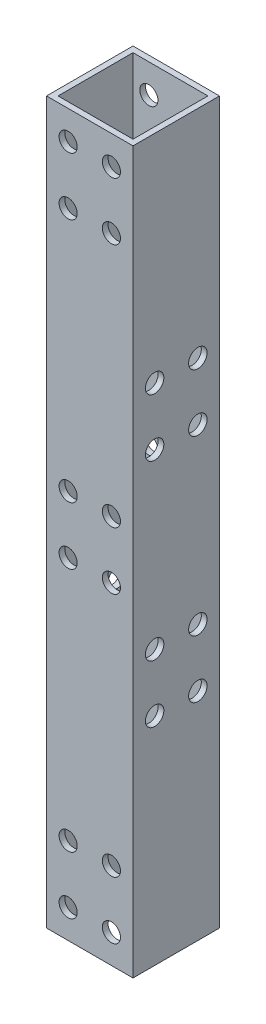
from build123d import *

# Parameters (mm, degrees)
SKETCH_1_W          = 15
SKETCH_1_H          = 15
SKETCH_1_W_2        = 13
SKETCH_1_H_2        = 13
EXTRUDE_1_DEPTH     = 125
CUT_EXTRUDE_1_REACH = 128.12
SKETCH_2_R          = 1.575
CUT_EXTRUDE_2_REACH = 128.12
SKETCH_3_R          = 1.6


with BuildPart() as part:
    # 草图1 → 凸台-拉伸1 (new body)
    with BuildSketch(Plane(origin=(0, 0, 0), x_dir=(1, 0, 0), z_dir=(0, 1, 0))):
        Rectangle(SKETCH_1_W, SKETCH_1_H)
        Rectangle(SKETCH_1_W_2, SKETCH_1_H_2, mode=Mode.SUBTRACT)
    extrude(amount=EXTRUDE_1_DEPTH)

    # 切除-拉伸1: up to this face of the body (flat: up to its plane)
    cut_extrude_1_end = Plane(part.part.faces().sort_by_distance((0, 62.5, -7.5))[0])
    # 草图2 → 切除-拉伸1 (cut, up to the picked face)
    with BuildSketch(Plane.XY.offset(7.5), mode=Mode.PRIVATE) as cut_extrude_1_sk1:
        with Locations((-3.75, 67.5)):
            Circle(SKETCH_2_R)
    cut_extrude_1_tool1 = split(extrude(cut_extrude_1_sk1.sketch, amount=-CUT_EXTRUDE_1_REACH, mode=Mode.PRIVATE), bisect_by=cut_extrude_1_end, keep=Keep.BOTH, mode=Mode.PRIVATE)
    # 草图2 → 切除-拉伸1 (cut, up to the picked face)
    with BuildSketch(Plane.XY.offset(7.5), mode=Mode.PRIVATE) as cut_extrude_1_sk2:
        with Locations((3.75, 67.5)):
            Circle(SKETCH_2_R)
    cut_extrude_1_tool2 = split(extrude(cut_extrude_1_sk2.sketch, amount=-CUT_EXTRUDE_1_REACH, mode=Mode.PRIVATE), bisect_by=cut_extrude_1_end, keep=Keep.BOTH, mode=Mode.PRIVATE)
    # 草图2 → 切除-拉伸1 (cut, up to the picked face)
    with BuildSketch(Plane.XY.offset(7.5), mode=Mode.PRIVATE) as cut_extrude_1_sk3:
        with Locations((-3.75, 57.5)):
            Circle(SKETCH_2_R)
    cut_extrude_1_tool3 = split(extrude(cut_extrude_1_sk3.sketch, amount=-CUT_EXTRUDE_1_REACH, mode=Mode.PRIVATE), bisect_by=cut_extrude_1_end, keep=Keep.BOTH, mode=Mode.PRIVATE)
    # 草图2 → 切除-拉伸1 (cut, up to the picked face)
    with BuildSketch(Plane.XY.offset(7.5), mode=Mode.PRIVATE) as cut_extrude_1_sk4:
        with Locations((3.75, 57.5)):
            Circle(SKETCH_2_R)
    cut_extrude_1_tool4 = split(extrude(cut_extrude_1_sk4.sketch, amount=-CUT_EXTRUDE_1_REACH, mode=Mode.PRIVATE), bisect_by=cut_extrude_1_end, keep=Keep.BOTH, mode=Mode.PRIVATE)
    # 草图2 → 切除-拉伸1 (cut, up to the picked face)
    with BuildSketch(Plane.XY.offset(7.5), mode=Mode.PRIVATE) as cut_extrude_1_sk5:
        with Locations((3.75, 120)):
            Circle(SKETCH_2_R)
    cut_extrude_1_tool5 = split(extrude(cut_extrude_1_sk5.sketch, amount=-CUT_EXTRUDE_1_REACH, mode=Mode.PRIVATE), bisect_by=cut_extrude_1_end, keep=Keep.BOTH, mode=Mode.PRIVATE)
    # 草图2 → 切除-拉伸1 (cut, up to the picked face)
    with BuildSketch(Plane.XY.offset(7.5), mode=Mode.PRIVATE) as cut_extrude_1_sk6:
        with Locations((-3.75, 120)):
            Circle(SKETCH_2_R)
    cut_extrude_1_tool6 = split(extrude(cut_extrude_1_sk6.sketch, amount=-CUT_EXTRUDE_1_REACH, mode=Mode.PRIVATE), bisect_by=cut_extrude_1_end, keep=Keep.BOTH, mode=Mode.PRIVATE)
    # 草图2 → 切除-拉伸1 (cut, up to the picked face)
    with BuildSketch(Plane.XY.offset(7.5), mode=Mode.PRIVATE) as cut_extrude_1_sk7:
        with Locations((-3.75, 110)):
            Circle(SKETCH_2_R)
    cut_extrude_1_tool7 = split(extrude(cut_extrude_1_sk7.sketch, amount=-CUT_EXTRUDE_1_REACH, mode=Mode.PRIVATE), bisect_by=cut_extrude_1_end, keep=Keep.BOTH, mode=Mode.PRIVATE)
    # 草图2 → 切除-拉伸1 (cut, up to the picked face)
    with BuildSketch(Plane.XY.offset(7.5), mode=Mode.PRIVATE) as cut_extrude_1_sk8:
        with Locations((3.75, 110)):
            Circle(SKETCH_2_R)
    cut_extrude_1_tool8 = split(extrude(cut_extrude_1_sk8.sketch, amount=-CUT_EXTRUDE_1_REACH, mode=Mode.PRIVATE), bisect_by=cut_extrude_1_end, keep=Keep.BOTH, mode=Mode.PRIVATE)
    # 草图2 → 切除-拉伸1 (cut, up to the picked face)
    with BuildSketch(Plane.XY.offset(7.5), mode=Mode.PRIVATE) as cut_extrude_1_sk9:
        with Locations((3.75, 15)):
            Circle(SKETCH_2_R)
    cut_extrude_1_tool9 = split(extrude(cut_extrude_1_sk9.sketch, amount=-CUT_EXTRUDE_1_REACH, mode=Mode.PRIVATE), bisect_by=cut_extrude_1_end, keep=Keep.BOTH, mode=Mode.PRIVATE)
    # 草图2 → 切除-拉伸1 (cut, up to the picked face)
    with BuildSketch(Plane.XY.offset(7.5), mode=Mode.PRIVATE) as cut_extrude_1_sk10:
        with Locations((-3.75, 15)):
            Circle(SKETCH_2_R)
    cut_extrude_1_tool10 = split(extrude(cut_extrude_1_sk10.sketch, amount=-CUT_EXTRUDE_1_REACH, mode=Mode.PRIVATE), bisect_by=cut_extrude_1_end, keep=Keep.BOTH, mode=Mode.PRIVATE)
    # 草图2 → 切除-拉伸1 (cut, up to the picked face)
    with BuildSketch(Plane.XY.offset(7.5), mode=Mode.PRIVATE) as cut_extrude_1_sk11:
        with Locations((-3.75, 5)):
            Circle(SKETCH_2_R)
    cut_extrude_1_tool11 = split(extrude(cut_extrude_1_sk11.sketch, amount=-CUT_EXTRUDE_1_REACH, mode=Mode.PRIVATE), bisect_by=cut_extrude_1_end, keep=Keep.BOTH, mode=Mode.PRIVATE)
    # 草图2 → 切除-拉伸1 (cut, up to the picked face)
    with BuildSketch(Plane.XY.offset(7.5), mode=Mode.PRIVATE) as cut_extrude_1_sk12:
        with Locations((3.75, 5)):
            Circle(SKETCH_2_R)
    cut_extrude_1_tool12 = split(extrude(cut_extrude_1_sk12.sketch, amount=-CUT_EXTRUDE_1_REACH, mode=Mode.PRIVATE), bisect_by=cut_extrude_1_end, keep=Keep.BOTH, mode=Mode.PRIVATE)
    add(cut_extrude_1_tool1.solids().sort_by(Axis((-3.75, 67.5, 7.5), (0, 0, -1)))[0], mode=Mode.SUBTRACT)
    add(cut_extrude_1_tool2.solids().sort_by(Axis((3.75, 67.5, 7.5), (0, 0, -1)))[0], mode=Mode.SUBTRACT)
    add(cut_extrude_1_tool3.solids().sort_by(Axis((-3.75, 57.5, 7.5), (0, 0, -1)))[0], mode=Mode.SUBTRACT)
    add(cut_extrude_1_tool4.solids().sort_by(Axis((3.75, 57.5, 7.5), (0, 0, -1)))[0], mode=Mode.SUBTRACT)
    add(cut_extrude_1_tool5.solids().sort_by(Axis((3.75, 120, 7.5), (0, 0, -1)))[0], mode=Mode.SUBTRACT)
    add(cut_extrude_1_tool6.solids().sort_by(Axis((-3.75, 120, 7.5), (0, 0, -1)))[0], mode=Mode.SUBTRACT)
    add(cut_extrude_1_tool7.solids().sort_by(Axis((-3.75, 110, 7.5), (0, 0, -1)))[0], mode=Mode.SUBTRACT)
    add(cut_extrude_1_tool8.solids().sort_by(Axis((3.75, 110, 7.5), (0, 0, -1)))[0], mode=Mode.SUBTRACT)
    add(cut_extrude_1_tool9.solids().sort_by(Axis((3.75, 15, 7.5), (0, 0, -1)))[0], mode=Mode.SUBTRACT)
    add(cut_extrude_1_tool10.solids().sort_by(Axis((-3.75, 15, 7.5), (0, 0, -1)))[0], mode=Mode.SUBTRACT)
    add(cut_extrude_1_tool11.solids().sort_by(Axis((-3.75, 5, 7.5), (0, 0, -1)))[0], mode=Mode.SUBTRACT)
    add(cut_extrude_1_tool12.solids().sort_by(Axis((3.75, 5, 7.5), (0, 0, -1)))[0], mode=Mode.SUBTRACT)

    # 切除-拉伸2: up to this face of the body (flat: up to its plane)
    cut_extrude_2_end = Plane(part.part.faces().sort_by_distance((7.5, 62.5, 0))[0])
    # 草图3 → 切除-拉伸2 (cut, up to the picked face)
    with BuildSketch(Plane.ZY.offset(7.5), mode=Mode.PRIVATE) as cut_extrude_2_sk1:
        with Locations((-3.75, 87.5)):
            Circle(SKETCH_3_R)
    cut_extrude_2_tool1 = split(extrude(cut_extrude_2_sk1.sketch, amount=-CUT_EXTRUDE_2_REACH, mode=Mode.PRIVATE), bisect_by=cut_extrude_2_end, keep=Keep.BOTH, mode=Mode.PRIVATE)
    # 草图3 → 切除-拉伸2 (cut, up to the picked face)
    with BuildSketch(Plane.ZY.offset(7.5), mode=Mode.PRIVATE) as cut_extrude_2_sk2:
        with Locations((3.75, 87.5)):
            Circle(SKETCH_3_R)
    cut_extrude_2_tool2 = split(extrude(cut_extrude_2_sk2.sketch, amount=-CUT_EXTRUDE_2_REACH, mode=Mode.PRIVATE), bisect_by=cut_extrude_2_end, keep=Keep.BOTH, mode=Mode.PRIVATE)
    # 草图3 → 切除-拉伸2 (cut, up to the picked face)
    with BuildSketch(Plane.ZY.offset(7.5), mode=Mode.PRIVATE) as cut_extrude_2_sk3:
        with Locations((-3.75, 77.5)):
            Circle(SKETCH_3_R)
    cut_extrude_2_tool3 = split(extrude(cut_extrude_2_sk3.sketch, amount=-CUT_EXTRUDE_2_REACH, mode=Mode.PRIVATE), bisect_by=cut_extrude_2_end, keep=Keep.BOTH, mode=Mode.PRIVATE)
    # 草图3 → 切除-拉伸2 (cut, up to the picked face)
    with BuildSketch(Plane.ZY.offset(7.5), mode=Mode.PRIVATE) as cut_extrude_2_sk4:
        with Locations((3.75, 77.5)):
            Circle(SKETCH_3_R)
    cut_extrude_2_tool4 = split(extrude(cut_extrude_2_sk4.sketch, amount=-CUT_EXTRUDE_2_REACH, mode=Mode.PRIVATE), bisect_by=cut_extrude_2_end, keep=Keep.BOTH, mode=Mode.PRIVATE)
    # 草图3 → 切除-拉伸2 (cut, up to the picked face)
    with BuildSketch(Plane.ZY.offset(7.5), mode=Mode.PRIVATE) as cut_extrude_2_sk5:
        with Locations((3.75, 47.5)):
            Circle(SKETCH_3_R)
    cut_extrude_2_tool5 = split(extrude(cut_extrude_2_sk5.sketch, amount=-CUT_EXTRUDE_2_REACH, mode=Mode.PRIVATE), bisect_by=cut_extrude_2_end, keep=Keep.BOTH, mode=Mode.PRIVATE)
    # 草图3 → 切除-拉伸2 (cut, up to the picked face)
    with BuildSketch(Plane.ZY.offset(7.5), mode=Mode.PRIVATE) as cut_extrude_2_sk6:
        with Locations((-3.75, 47.5)):
            Circle(SKETCH_3_R)
    cut_extrude_2_tool6 = split(extrude(cut_extrude_2_sk6.sketch, amount=-CUT_EXTRUDE_2_REACH, mode=Mode.PRIVATE), bisect_by=cut_extrude_2_end, keep=Keep.BOTH, mode=Mode.PRIVATE)
    # 草图3 → 切除-拉伸2 (cut, up to the picked face)
    with BuildSketch(Plane.ZY.offset(7.5), mode=Mode.PRIVATE) as cut_extrude_2_sk7:
        with Locations((3.75, 37.5)):
            Circle(SKETCH_3_R)
    cut_extrude_2_tool7 = split(extrude(cut_extrude_2_sk7.sketch, amount=-CUT_EXTRUDE_2_REACH, mode=Mode.PRIVATE), bisect_by=cut_extrude_2_end, keep=Keep.BOTH, mode=Mode.PRIVATE)
    # 草图3 → 切除-拉伸2 (cut, up to the picked face)
    with BuildSketch(Plane.ZY.offset(7.5), mode=Mode.PRIVATE) as cut_extrude_2_sk8:
        with Locations((-3.75, 37.5)):
            Circle(SKETCH_3_R)
    cut_extrude_2_tool8 = split(extrude(cut_extrude_2_sk8.sketch, amount=-CUT_EXTRUDE_2_REACH, mode=Mode.PRIVATE), bisect_by=cut_extrude_2_end, keep=Keep.BOTH, mode=Mode.PRIVATE)
    add(cut_extrude_2_tool1.solids().sort_by(Axis((-7.5, 87.5, -3.75), (1, 0, 0)))[0], mode=Mode.SUBTRACT)
    add(cut_extrude_2_tool2.solids().sort_by(Axis((-7.5, 87.5, 3.75), (1, 0, 0)))[0], mode=Mode.SUBTRACT)
    add(cut_extrude_2_tool3.solids().sort_by(Axis((-7.5, 77.5, -3.75), (1, 0, 0)))[0], mode=Mode.SUBTRACT)
    add(cut_extrude_2_tool4.solids().sort_by(Axis((-7.5, 77.5, 3.75), (1, 0, 0)))[0], mode=Mode.SUBTRACT)
    add(cut_extrude_2_tool5.solids().sort_by(Axis((-7.5, 47.5, 3.75), (1, 0, 0)))[0], mode=Mode.SUBTRACT)
    add(cut_extrude_2_tool6.solids().sort_by(Axis((-7.5, 47.5, -3.75), (1, 0, 0)))[0], mode=Mode.SUBTRACT)
    add(cut_extrude_2_tool7.solids().sort_by(Axis((-7.5, 37.5, 3.75), (1, 0, 0)))[0], mode=Mode.SUBTRACT)
    add(cut_extrude_2_tool8.solids().sort_by(Axis((-7.5, 37.5, -3.75), (1, 0, 0)))[0], mode=Mode.SUBTRACT)


solid = part.part
